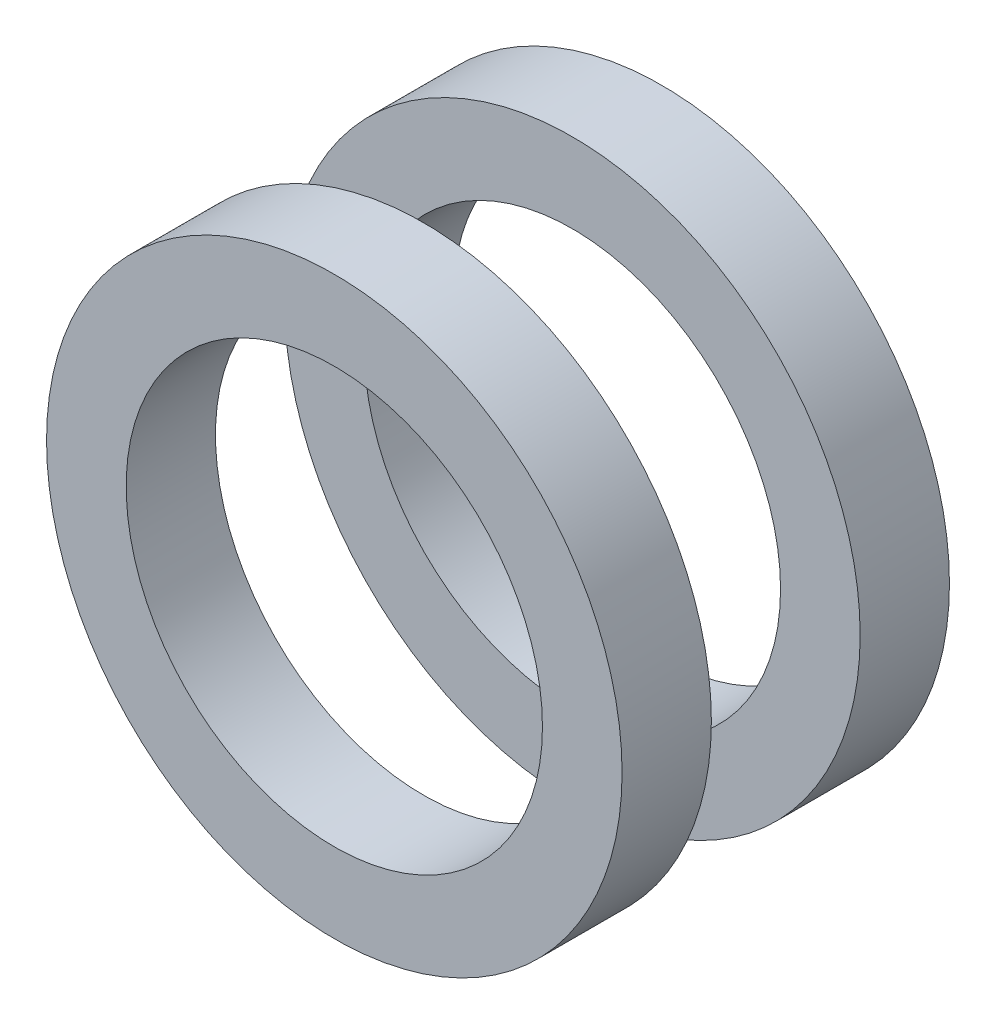
from build123d import *

# Parameters (mm, degrees)
ENDTURN_R_START = 15
SKETCH_1_R      = 58.015384615
SKETCH_1_R_2    = 41.961538462
ENDTURN_R_DEPTH = 18
ENDTURN_L_START = -33
SKETCH_2_R      = 58.015384615
SKETCH_2_R_2    = 41.961538462
ENDTURN_L_DEPTH = 18


with BuildPart() as part:
    # Эскиз1 → Endturn_R (new body)
    with BuildSketch(Plane.XY.offset(ENDTURN_R_START)):
        Circle(SKETCH_1_R)
        Circle(SKETCH_1_R_2, mode=Mode.SUBTRACT)
    extrude(amount=ENDTURN_R_DEPTH)


with BuildPart() as body_2:
    # Эскиз2 → Endturn_L (new body)
    with BuildSketch(Plane.XY.offset(ENDTURN_L_START)):
        Circle(SKETCH_2_R)
        Circle(SKETCH_2_R_2, mode=Mode.SUBTRACT)
    extrude(amount=ENDTURN_L_DEPTH)


solid = Compound([part.part, body_2.part])
